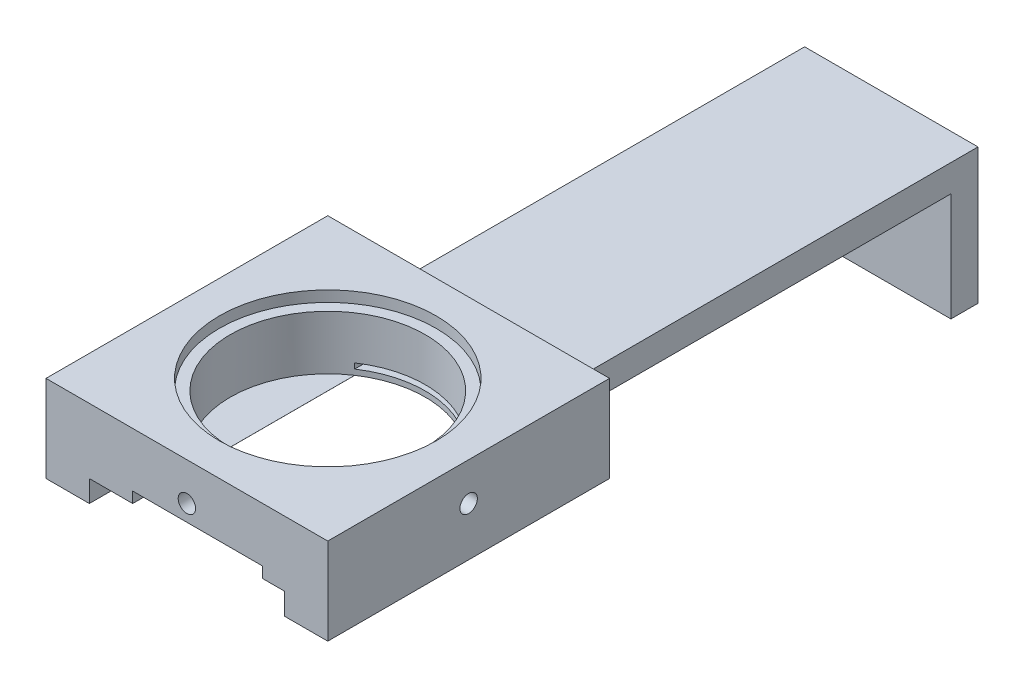
from build123d import *

# Parameters (mm, degrees)
BOSS_EXTRUDE1_DEPTH          = 7.9375
SKETCH2_W                    = 50.8
SKETCH2_H                    = 7.9375
BOSS_EXTRUDE2_DEPTH          = 31.75
SKETCH8_W                    = 82.55
SKETCH8_H                    = 82.55
BOSS_EXTRUDE6_DEPTH          = 7.9375
SKETCH10_R                   = 6.35
CENTER_HOLE_DEPTH            = 15.875
SKETCH12_W                   = 12.7
SKETCH12_H                   = 82.55
CLAMP_PAD_DEPTH              = 9.525
SKETCH13_W                   = 12.7
SKETCH13_H                   = 82.55
SKETCH13_W_2                 = 6.35
WEAR_PAD_DEPTH               = 3.175
SKETCH14_W                   = 82.55
SKETCH14_H                   = 82.55
BOSS_EXTRUDE10_DEPTH         = 0.014283
SKETCH15_R                   = 28.575
CUT_EXTRUDE3_DEPTH           = 19.05
BOSS_EXTRUDE7_START          = 1.5875
SKETCH11_R                   = 38.1
SKETCH11_R_2                 = 28.575
BOSS_EXTRUDE7_DEPTH          = 1.5875
SKETCH24_R                   = 31.75
CUT_EXTRUDE4_DEPTH           = 3.175
F_1_4_20_TAPPED_HOLE5_REACH  = 213.114
F_1_4_20_TAPPED_HOLE5_BORE_R = 2.5527
F_1_4_20_TAPPED_HOLE6_REACH  = 188.036
F_1_4_20_TAPPED_HOLE6_BORE_R = 2.5527
F_1_4_20_TAPPED_HOLE7_D      = 5.1054
F_1_4_20_TAPPED_HOLE7_DEPTH  = 16.51
F_1_4_20_TAPPED_HOLE7_TIP    = 1.533816902
F_1_4_20_TAPPED_HOLE8_D      = 5.1054
F_1_4_20_TAPPED_HOLE8_DEPTH  = 16.51
F_1_4_20_TAPPED_HOLE8_TIP    = 1.533816902


with BuildPart() as part:
    # Sketch1 → Boss-Extrude1 (new body)
    with BuildSketch(Plane(origin=(0, 0, 0), x_dir=(1, 0, 0), z_dir=(0, 1, 0))):
        Polygon((-22.225, 41.275), (-41.275, 41.275), (-41.275, -41.275), (41.275, -41.275), (41.275, 41.275), (28.575, 41.275), (28.575, 161.925), (-22.225, 161.925), align=None)
    extrude(amount=-BOSS_EXTRUDE1_DEPTH)

    # Sketch2 → Boss-Extrude2 (add)
    with BuildSketch(Plane.XZ.offset(7.9375)):
        with Locations((3.175, -157.95625)):
            Rectangle(SKETCH2_W, SKETCH2_H)
    extrude(amount=BOSS_EXTRUDE2_DEPTH)

    # Sketch8 → Boss-Extrude6 (add)
    with BuildSketch(Plane(origin=(0, 0, 0), x_dir=(1, 0, 0), z_dir=(0, 1, 0))):
        Rectangle(SKETCH8_W, SKETCH8_H)
    extrude(amount=BOSS_EXTRUDE6_DEPTH)

    # Sketch10 → Center Hole (cut)
    with BuildSketch(Plane(origin=(0, 7.9375, 0), x_dir=(1, 0, 0), z_dir=(0, 1, 0))):
        with Locations(Location((0, 0, 0), (0, 0, 270))):
            Circle(SKETCH10_R)
    extrude(amount=-CENTER_HOLE_DEPTH, mode=Mode.SUBTRACT)

    # Sketch12 → Clamp Pad (add)
    with BuildSketch(Plane.XZ.offset(7.9375)):
        with Locations((-34.925, 0)):
            Rectangle(SKETCH12_W, SKETCH12_H)
        with Locations((34.925, 0)):
            Rectangle(SKETCH12_W, SKETCH12_H)
    extrude(amount=CLAMP_PAD_DEPTH)

    # Sketch13 → Wear Pad (add)
    with BuildSketch(Plane.XZ.offset(7.9375)):
        with Locations((-22.225, 0)):
            Rectangle(SKETCH13_W, SKETCH13_H)
        with Locations((25.4, 0)):
            Rectangle(SKETCH13_W_2, SKETCH13_H)
    extrude(amount=WEAR_PAD_DEPTH)

    # Sketch14 → Boss-Extrude10 (add)
    with BuildSketch(Plane(origin=(0, 7.9375, 0), x_dir=(1, 0, 0), z_dir=(0, 1, 0))):
        Rectangle(SKETCH14_W, SKETCH14_H)
    extrude(amount=BOSS_EXTRUDE10_DEPTH)

    # Sketch15 → Cut-Extrude3 (cut)
    with BuildSketch(Plane(origin=(0, 7.951783292, 0), x_dir=(1, 0, 0), z_dir=(0, 1, 0))):
        with Locations(Location((0, 0, 0), (0, 0, 270))):
            Circle(SKETCH15_R)
    extrude(amount=-CUT_EXTRUDE3_DEPTH, mode=Mode.SUBTRACT)

    # Sketch11 → Boss-Extrude7 (add)
    with BuildSketch(Plane(origin=(0, -11.098216708, 0), x_dir=(1, 0, 0), z_dir=(0, 1, 0)).offset(BOSS_EXTRUDE7_START)):
        Circle(SKETCH11_R)
        with Locations(Location((0, 0, 0), (0, 0, 270))):
            Circle(SKETCH11_R_2, mode=Mode.SUBTRACT)
    extrude(amount=-BOSS_EXTRUDE7_DEPTH)

    # Sketch24 → Cut-Extrude4 (cut)
    with BuildSketch(Plane(origin=(0, 7.951783292, 0), x_dir=(1, 0, 0), z_dir=(0, 1, 0))):
        with Locations(Location((0, 0, 0), (0, 0, 270))):
            Circle(SKETCH24_R)
    extrude(amount=-CUT_EXTRUDE4_DEPTH, mode=Mode.SUBTRACT)

    # 1/4-20 Tapped Hole5 bore → 1/4-20 Tapped Hole5 (cut, up to next)
    with BuildSketch(Plane.XY.offset(41.275), mode=Mode.PRIVATE) as f_1_4_20_tapped_hole5_sk1:
        with Locations((0, -3.160716708)):
            Circle(F_1_4_20_TAPPED_HOLE5_BORE_R)
    f_1_4_20_tapped_hole5_tool1 = extrude(f_1_4_20_tapped_hole5_sk1.sketch, amount=-F_1_4_20_TAPPED_HOLE5_REACH, mode=Mode.PRIVATE) & part.part
    add(f_1_4_20_tapped_hole5_tool1.solids().sort_by_distance((0, -3.160717, 41.275))[0], mode=Mode.SUBTRACT)

    # 1/4-20 Tapped Hole6 bore → 1/4-20 Tapped Hole6 (cut, up to next)
    with BuildSketch(Plane(origin=(41.275, 0, 0), x_dir=(0, 0, -1), z_dir=(1, 0, 0)), mode=Mode.PRIVATE) as f_1_4_20_tapped_hole6_sk1:
        with Locations((0, -3.160716708)):
            Circle(F_1_4_20_TAPPED_HOLE6_BORE_R)
    f_1_4_20_tapped_hole6_tool1 = extrude(f_1_4_20_tapped_hole6_sk1.sketch, amount=-F_1_4_20_TAPPED_HOLE6_REACH, mode=Mode.PRIVATE) & part.part
    add(f_1_4_20_tapped_hole6_tool1.solids().sort_by_distance((41.275, -3.160717, 0))[0], mode=Mode.SUBTRACT)

    # 1/4-20 Tapped Hole7
    with Locations(Plane(origin=(0, -17.4625, 0), x_dir=(-1, 0, 0), z_dir=(0, -1, 0))):
        with Locations((33.3375, 19.05), (33.3375, -19.05)):
            Hole(F_1_4_20_TAPPED_HOLE7_D / 2, depth=F_1_4_20_TAPPED_HOLE7_DEPTH)
            with Locations((0, 0, -(F_1_4_20_TAPPED_HOLE7_DEPTH + F_1_4_20_TAPPED_HOLE7_TIP / 2))):  # 118° drill point
                Cone(0, F_1_4_20_TAPPED_HOLE7_D / 2, F_1_4_20_TAPPED_HOLE7_TIP, mode=Mode.SUBTRACT)

    # 1/4-20 Tapped Hole8
    with Locations(Plane(origin=(0, -17.4625, 0), x_dir=(-1, 0, 0), z_dir=(0, -1, 0))):
        with Locations((-33.3375, 19.05), (-33.3375, -19.05)):
            Hole(F_1_4_20_TAPPED_HOLE8_D / 2, depth=F_1_4_20_TAPPED_HOLE8_DEPTH)
            with Locations((0, 0, -(F_1_4_20_TAPPED_HOLE8_DEPTH + F_1_4_20_TAPPED_HOLE8_TIP / 2))):  # 118° drill point
                Cone(0, F_1_4_20_TAPPED_HOLE8_D / 2, F_1_4_20_TAPPED_HOLE8_TIP, mode=Mode.SUBTRACT)


solid = part.part
